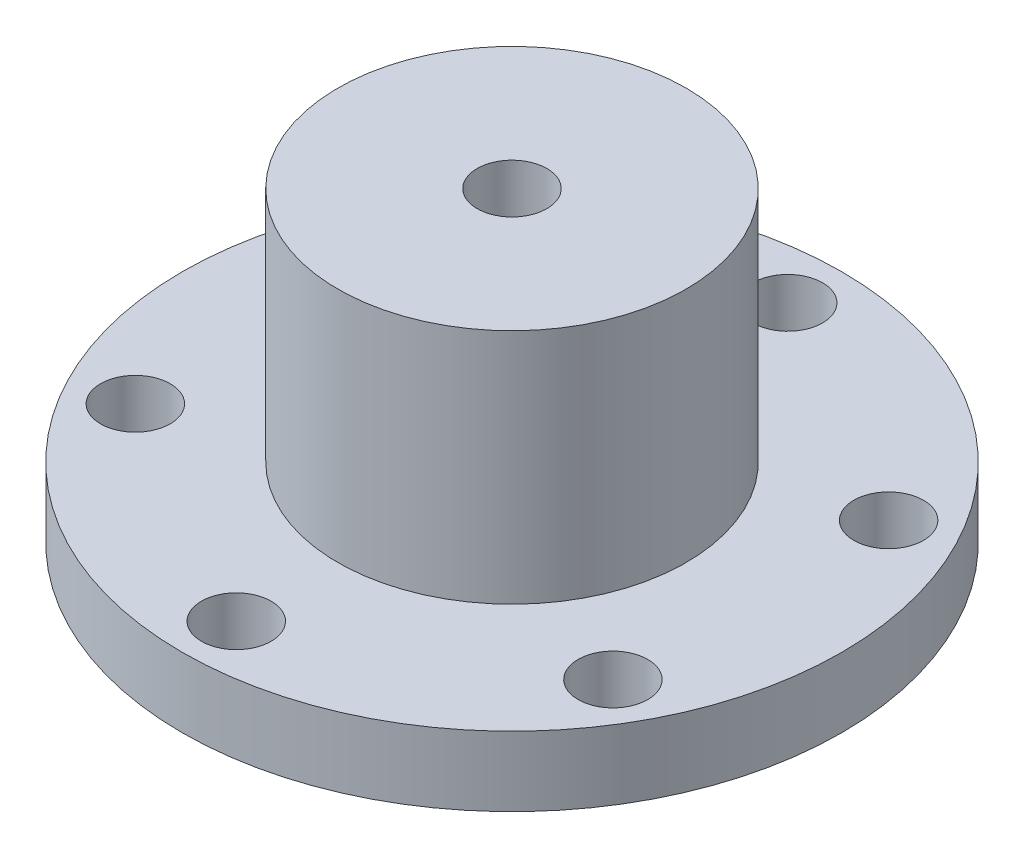
from build123d import *

# Parameters (mm, degrees)
SKETCH2_R          = 3
CUT_EXTRUDE1_DEPTH = 46.047530454


with BuildPart() as part:
    # Sketch1 → Revolve1 (revolve)
    with BuildSketch(Plane(origin=(0, 0, 0), x_dir=(0, 0, -1), z_dir=(1, 0, 0)), mode=Mode.PRIVATE) as revolve1_sk:
        Polygon((-3, 0), (-28.4, 0), (-28.4, 6), (-15, 6), (-15, 26.4), (-3, 26.4), align=None)
    revolve(revolve1_sk.sketch.rotate(Axis((0, 0, 0), (0, 1, 0)), 180), axis=Axis((0, 0, 0), (0, 1, 0)))

    # Sketch2 → Cut-Extrude1 (cut, through all)
    with BuildSketch(Plane(origin=(0, 6, 0), x_dir=(1, 0, 0), z_dir=(0, 1, 0))):
        with Locations(Location((0, 23.75, 0), (0, 0, 270))):
            Circle(SKETCH2_R)
        with Locations(Location((20.56810334, 11.875, 0), (0, 0, 270))):
            Circle(SKETCH2_R)
        with Locations(Location((20.56810334, -11.875, 0), (0, 0, 270))):
            Circle(SKETCH2_R)
        with Locations(Location((0, -23.75, 0), (0, 0, 270))):
            Circle(SKETCH2_R)
        with Locations(Location((-20.56810334, -11.875, 0), (0, 0, 270))):
            Circle(SKETCH2_R)
        with Locations(Location((-20.56810334, 11.875, 0), (0, 0, 270))):
            Circle(SKETCH2_R)
    extrude(amount=-CUT_EXTRUDE1_DEPTH, mode=Mode.SUBTRACT)


solid = part.part
